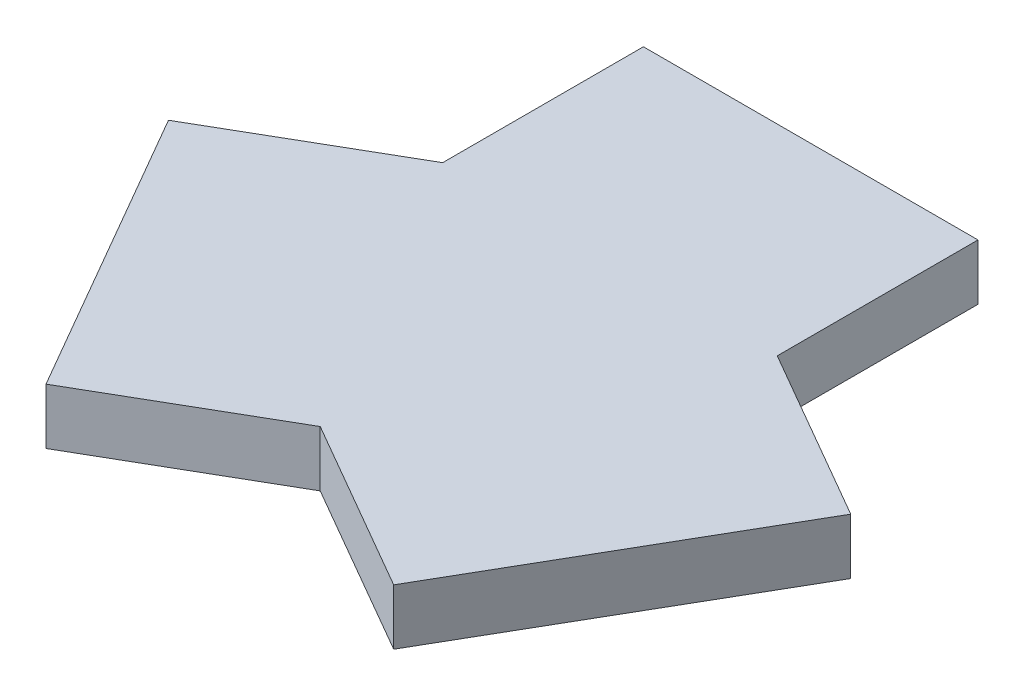
from build123d import *

# Parameters (mm, degrees)
BOSS_EXTRUDE1_DEPTH = 1.25


with BuildPart() as part:
    # Sketch1 → Boss-Extrude1 (new, symmetric)
    with BuildSketch(Plane(origin=(0, 0, 0), x_dir=(1, 0, 0), z_dir=(0, 1, 0))):
        Polygon((15.294228634, 0.5), (7.5, 5), (7.5, 14), (-7.5, 14), (-7.5, 5), (-15.294228634, 0.5), (-7.794228634, -12.490381057), (0, -7.990381057), (7.794228634, -12.490381057), align=None)
    extrude(amount=BOSS_EXTRUDE1_DEPTH, both=True)


solid = part.part
